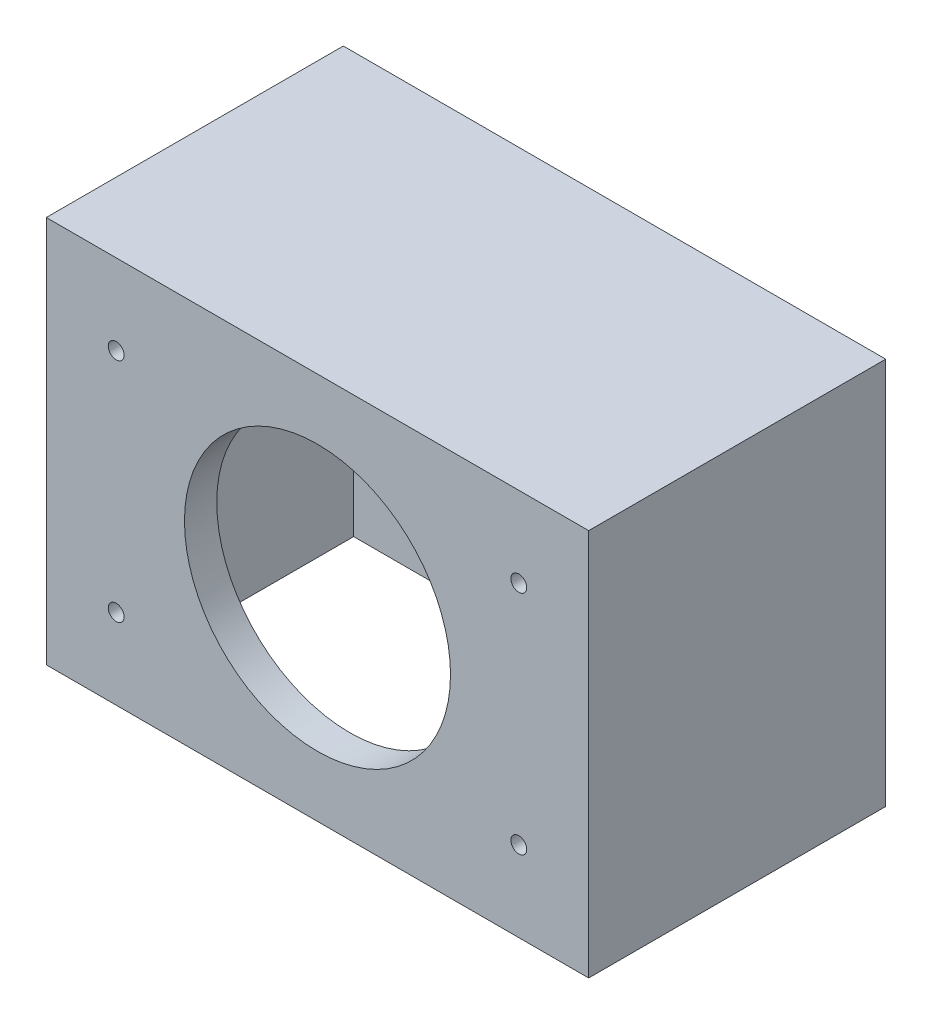
from build123d import *

# Parameters (mm, degrees)
SKETCH1_W           = 210
SKETCH1_H           = 150
BOSS_EXTRUDE1_DEPTH = 115
SKETCH3_W           = 176.973663014
SKETCH3_H           = 90
CUT_EXTRUDE1_DEPTH  = 129
CUT_EXTRUDE2_REACH  = 174.844
SKETCH4_R           = 3.0725
CUT_EXTRUDE3_REACH  = 174.844
SKETCH5_R           = 51.5


with BuildPart() as part:
    # Sketch1 → Boss-Extrude1 (new body)
    with BuildSketch(Plane.XY):
        Rectangle(SKETCH1_W, SKETCH1_H)
    extrude(amount=BOSS_EXTRUDE1_DEPTH)

    # Sketch3 → Cut-Extrude1 (cut)
    with BuildSketch(Plane.XZ.offset(75)):
        with Locations((0, 57.5)):
            Rectangle(SKETCH3_W, SKETCH3_H)
    extrude(amount=-CUT_EXTRUDE1_DEPTH, mode=Mode.SUBTRACT)

    # Sketch4 → Cut-Extrude2 (cut, up to next)
    with BuildSketch(Plane.XY.offset(115), mode=Mode.PRIVATE) as cut_extrude2_sk1:
        with Locations((77.942286341, 43.874821937)):
            Circle(SKETCH4_R)
    cut_extrude2_tool1 = extrude(cut_extrude2_sk1.sketch, amount=-CUT_EXTRUDE2_REACH, mode=Mode.PRIVATE) & part.part
    # Sketch4 → Cut-Extrude2 (cut, up to next)
    with BuildSketch(Plane.XY.offset(115), mode=Mode.PRIVATE) as cut_extrude2_sk2:
        with Locations((-77.942286341, 43.874821937)):
            Circle(SKETCH4_R)
    cut_extrude2_tool2 = extrude(cut_extrude2_sk2.sketch, amount=-CUT_EXTRUDE2_REACH, mode=Mode.PRIVATE) & part.part
    # Sketch4 → Cut-Extrude2 (cut, up to next)
    with BuildSketch(Plane.XY.offset(115), mode=Mode.PRIVATE) as cut_extrude2_sk3:
        with Locations((-77.942286341, -43.874821937)):
            Circle(SKETCH4_R)
    cut_extrude2_tool3 = extrude(cut_extrude2_sk3.sketch, amount=-CUT_EXTRUDE2_REACH, mode=Mode.PRIVATE) & part.part
    # Sketch4 → Cut-Extrude2 (cut, up to next)
    with BuildSketch(Plane.XY.offset(115), mode=Mode.PRIVATE) as cut_extrude2_sk4:
        with Locations((77.942286341, -43.874821937)):
            Circle(SKETCH4_R)
    cut_extrude2_tool4 = extrude(cut_extrude2_sk4.sketch, amount=-CUT_EXTRUDE2_REACH, mode=Mode.PRIVATE) & part.part
    add(cut_extrude2_tool1.solids().sort_by_distance((77.942286, 43.874822, 115))[0], mode=Mode.SUBTRACT)
    add(cut_extrude2_tool2.solids().sort_by_distance((-77.942286, 43.874822, 115))[0], mode=Mode.SUBTRACT)
    add(cut_extrude2_tool3.solids().sort_by_distance((-77.942286, -43.874822, 115))[0], mode=Mode.SUBTRACT)
    add(cut_extrude2_tool4.solids().sort_by_distance((77.942286, -43.874822, 115))[0], mode=Mode.SUBTRACT)

    # Sketch5 → Cut-Extrude3 (cut, up to next)
    with BuildSketch(Plane.XY.offset(115), mode=Mode.PRIVATE) as cut_extrude3_sk1:
        Circle(SKETCH5_R)
    cut_extrude3_tool1 = extrude(cut_extrude3_sk1.sketch, amount=-CUT_EXTRUDE3_REACH, mode=Mode.PRIVATE) & part.part
    add(cut_extrude3_tool1.solids().sort_by_distance((0, 0, 115))[0], mode=Mode.SUBTRACT)


solid = part.part
